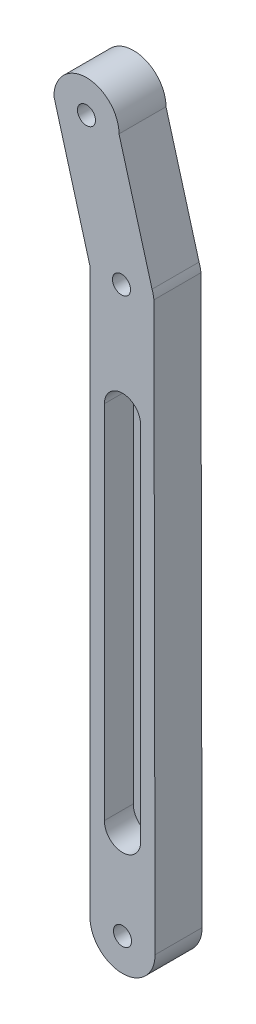
from build123d import *

# Parameters (mm, degrees)
SKETCH1_R      = 2.5
EXTRUDE1_DEPTH = 13
EXTRUDE2_DEPTH = 8


with BuildPart() as part:
    # Sketch1 → Extrude1 (new body)
    with BuildSketch(Plane.XY):
        with BuildLine():
            Line((-11.114615619, 113.277430864), (-11.114615619, -42.636308558))
            ThreePointArc((-11.114615619, -42.636308558), (-2.114615619, -51.636308558), (6.885384381, -42.636308558))
            Line((6.885384381, -42.636308558), (6.565118116, 114.072785693))
            ThreePointArc((6.565118116, 114.072785693), (6.384581051, 115.236243879), (6.053710916, 116.36617907))
            Line((6.053710916, 116.36617907), (-3.084934036, 148.987312466))
            ThreePointArc((-3.084934036, 148.987312466), (-12.084934036, 157.987312466), (-21.084934036, 148.987312466))
            Line((-21.084934036, 148.987312466), (-11.114615619, 113.277430864))
        make_face()
        with Locations(Location((-2.399669149, 113.277430864, 0), (0, 0, 180))):
            Circle(SKETCH1_R, mode=Mode.SUBTRACT)
        with Locations(Location((-2.114615619, -42.636308558, 0), (0, 0, 180))):
            Circle(SKETCH1_R, mode=Mode.SUBTRACT)
        with Locations(Location((-12.084934036, 148.987312466, 0), (0, 0, 180))):
            Circle(SKETCH1_R, mode=Mode.SUBTRACT)
    extrude(amount=EXTRUDE1_DEPTH)

    # Sketch2 → Extrude2 (cut)
    with BuildSketch(Plane.XY.offset(13)):
        with BuildLine():
            Line((2.885384381, 82.363691442), (2.828618024, -16.885015572))
            ThreePointArc((2.828618024, -16.885015572), (-1.817326792, -22.627462668), (-7.112080712, -17.477114833))
            Line((-7.112080712, -17.477114833), (-7.114615619, 82.363691442))
            ThreePointArc((-7.114615619, 82.363691442), (-2.114615619, 87.363691442), (2.885384381, 82.363691442))
        make_face()
    extrude(amount=-EXTRUDE2_DEPTH, mode=Mode.SUBTRACT)


solid = part.part
